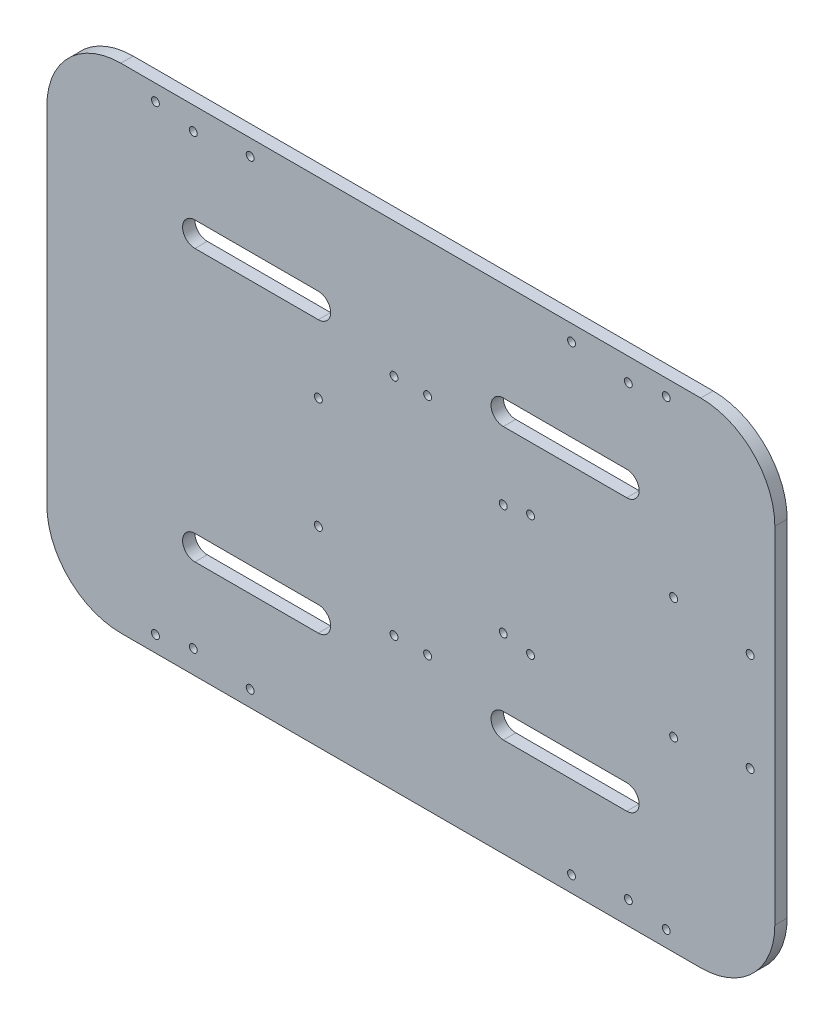
from build123d import *

# Parameters (mm, degrees)
SKETCH_1_W             = 295
SKETCH_1_H             = 200
EXTRUDE_1_DEPTH        = 5
SKETCH_2_R             = 1.6
CUT_EXTRUDE_549_DEPTH  = 357.440738412
SKETCH_3_R             = 1.6
CUT_EXTRUDE_902_DEPTH  = 5
SKETCH_4_R             = 1.6
CUT_EXTRUDE_1255_DEPTH = 5
SKETCH_5_R             = 1.6
CUT_EXTRUDE_1670_DEPTH = 5
SKETCH_8_R             = 1.6
CUT_EXTRUDE_2229_DEPTH = 50
SKETCH_10_R            = 1.6
CUT_EXTRUDE_2729_DEPTH = 357.440738412
CUT_EXTRUDE_3337_DEPTH = 10
FILLET_1_R             = 30


with BuildPart() as part:
    # 草图1 → 凸台-拉伸1 (new body)
    with BuildSketch(Plane.XY):
        with Locations((147.5, 100)):
            Rectangle(SKETCH_1_W, SKETCH_1_H)
    extrude(amount=EXTRUDE_1_DEPTH)

    # 草图2 → Cut-Extrude 549 (cut, through all)
    with BuildSketch(Plane.XY.offset(5)):
        with Locations((285, 120)):
            Circle(SKETCH_2_R)
        with Locations(Location((285, 80, 0), (0, 0, 180))):
            Circle(SKETCH_2_R)
    extrude(amount=-CUT_EXTRUDE_549_DEPTH, mode=Mode.SUBTRACT)

    # 草图3 → Cut-Extrude 902 (cut)
    with BuildSketch(Plane.XY.offset(5)):
        with Locations((251, 6.5)):
            Circle(SKETCH_3_R)
        with Locations((212.6, 6.5)):
            Circle(SKETCH_3_R)
        with Locations(Location((44, 6.5, 0), (0, 0, 180))):
            Circle(SKETCH_3_R)
        with Locations(Location((82.4, 6.5, 0), (0, 0, 180))):
            Circle(SKETCH_3_R)
        with Locations(Location((251, 193.5, 0), (0, 0, 180))):
            Circle(SKETCH_3_R)
        with Locations(Location((212.6, 193.5, 0), (0, 0, 180))):
            Circle(SKETCH_3_R)
        with Locations((82.4, 193.5)):
            Circle(SKETCH_3_R)
        with Locations((44, 193.5)):
            Circle(SKETCH_3_R)
    extrude(amount=-CUT_EXTRUDE_902_DEPTH, mode=Mode.SUBTRACT)

    # 草图4 → Cut-Extrude 1255 (cut)
    with BuildSketch(Plane.XY.offset(5)):
        with Locations((196, 124.5)):
            Circle(SKETCH_4_R)
        with Locations((254, 124.5)):
            Circle(SKETCH_4_R)
        with Locations((254, 75.5)):
            Circle(SKETCH_4_R)
        with Locations((196, 75.5)):
            Circle(SKETCH_4_R)
    extrude(amount=-CUT_EXTRUDE_1255_DEPTH, mode=Mode.SUBTRACT)

    # 草图5 → Cut-Extrude 1670 (cut)
    with BuildSketch(Plane.XY.offset(5)):
        with Locations((110.04, 122.5)):
            Circle(SKETCH_5_R)
        with Locations((184.96, 122.5)):
            Circle(SKETCH_5_R)
        with Locations((184.96, 77.5)):
            Circle(SKETCH_5_R)
        with Locations((110.04, 77.5)):
            Circle(SKETCH_5_R)
    extrude(amount=-CUT_EXTRUDE_1670_DEPTH, mode=Mode.SUBTRACT)

    # 草图8 → Cut-Extrude 2229 (cut)
    with BuildSketch(Plane.XY.offset(5)):
        with Locations((154.299232912, 145.494729715)):
            Circle(SKETCH_8_R)
        with Locations(Location((140.700767088, 145.494729715, 0), (0, 0, 180))):
            Circle(SKETCH_8_R)
        with Locations(Location((154.299232912, 54.505270285, 0), (0, 0, 180))):
            Circle(SKETCH_8_R)
        with Locations((140.700767088, 54.505270285)):
            Circle(SKETCH_8_R)
    extrude(amount=-CUT_EXTRUDE_2229_DEPTH, mode=Mode.SUBTRACT)

    # 草图10 → Cut-Extrude 2729 (cut, through all)
    with BuildSketch(Plane.XY.offset(5)):
        with Locations((59.36, 190.7)):
            Circle(SKETCH_10_R)
        with Locations(Location((235.64, 190.7, 0), (0, 0, 180))):
            Circle(SKETCH_10_R)
        with Locations((235.64, 9.3)):
            Circle(SKETCH_10_R)
        with Locations(Location((59.36, 9.3, 0), (0, 0, 180))):
            Circle(SKETCH_10_R)
    extrude(amount=-CUT_EXTRUDE_2729_DEPTH, mode=Mode.SUBTRACT)

    # 草图11 → Cut-Extrude 3337 (cut)
    with BuildSketch(Plane.XY.offset(5)):
        with BuildLine():
            Line((60, 160), (110, 160))
            ThreePointArc((110, 160), (115, 155), (110, 150))
            Line((110, 150), (60, 150))
            ThreePointArc((60, 150), (55, 155), (60, 160))
        make_face()
        with BuildLine():
            Line((60, 40), (110, 40))
            ThreePointArc((110, 40), (115, 45), (110, 50))
            Line((110, 50), (60, 50))
            ThreePointArc((60, 50), (55, 45), (60, 40))
        make_face()
        with BuildLine():
            Line((235, 40), (185, 40))
            ThreePointArc((185, 40), (180, 45), (185, 50))
            Line((185, 50), (235, 50))
            ThreePointArc((235, 50), (240, 45), (235, 40))
        make_face()
        with BuildLine():
            Line((235, 160), (185, 160))
            ThreePointArc((185, 160), (180, 155), (185, 150))
            Line((185, 150), (235, 150))
            ThreePointArc((235, 150), (240, 155), (235, 160))
        make_face()
    extrude(amount=-CUT_EXTRUDE_3337_DEPTH, mode=Mode.SUBTRACT)

    # 圆角1
    fillet_1_edges = [part.edges().sort_by_distance(p)[0] for p in [
        (0, 200, 2.5),
        (295, 200, 2.5),
        (295, 0, 2.5),
        (0, 0, 2.5),
    ]]
    fillet(fillet_1_edges, radius=FILLET_1_R)


solid = part.part
